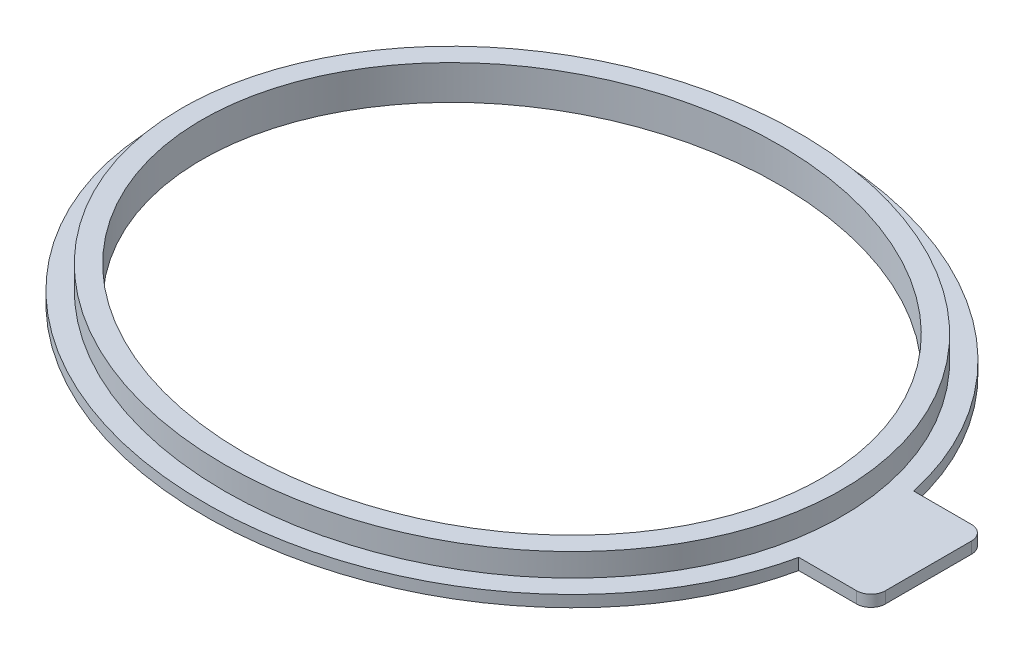
from build123d import *

# Parameters (mm, degrees)
SKETCH1_RX          = 115
SKETCH1_RY          = 100
SKETCH1_RX_2        = 108
SKETCH1_RY_2        = 93
BOSS_EXTRUDE1_DEPTH = 12
SKETCH2_RX          = 122
SKETCH2_RY          = 107
SKETCH2_RX_2        = 108
SKETCH2_RY_2        = 93
BOSS_EXTRUDE2_DEPTH = 4
BOSS_EXTRUDE3_DEPTH = 4
FILLET1_R           = 5


with BuildPart() as part:
    # Sketch1 → Boss-Extrude1 (new body)
    with BuildSketch(Plane(origin=(0, 0, 0), x_dir=(1, 0, 0), z_dir=(0, 1, 0))):
        with Locations(Location((0, 0), (0, 0, 180))):
            Ellipse(SKETCH1_RX, SKETCH1_RY)
        with Locations((0, 0)):
            Ellipse(SKETCH1_RX_2, SKETCH1_RY_2, mode=Mode.SUBTRACT)
    extrude(amount=BOSS_EXTRUDE1_DEPTH)

    # Sketch2 → Boss-Extrude2 (add)
    with BuildSketch(Plane(origin=(0, 0, 0), x_dir=(1, 0, 0), z_dir=(0, 1, 0))):
        with Locations(Location((0, 0), (0, 0, 180))):
            Ellipse(SKETCH2_RX, SKETCH2_RY)
        with Locations(Location((0, 0), (0, 0, 180))):
            Ellipse(SKETCH2_RX_2, SKETCH2_RY_2, mode=Mode.SUBTRACT)
    extrude(amount=BOSS_EXTRUDE2_DEPTH)

    # Sketch3 → Boss-Extrude3 (add)
    with BuildSketch(Plane(origin=(0, 0, 0), x_dir=(1, 0, 0), z_dir=(0, 1, 0))):
        Polygon((115, -20), (145, -20), (145, 20), (115, 20), (115, 0), align=None)
    extrude(amount=BOSS_EXTRUDE3_DEPTH)

    # Fillet1
    fillet1_edges = [part.edges().sort_by_distance(p)[0] for p in [
        (145, 2, -20),
        (145, 2, 20),
    ]]
    fillet(fillet1_edges, radius=FILLET1_R)


solid = part.part
